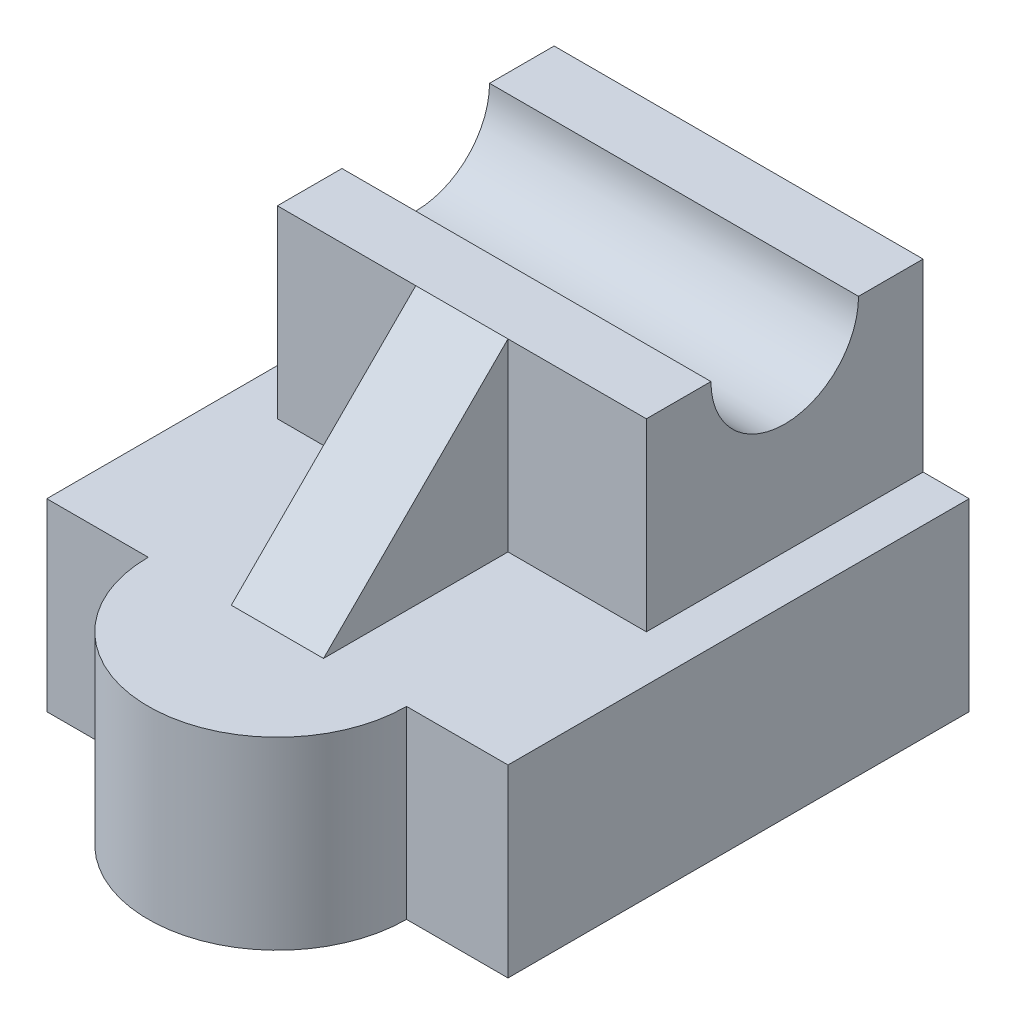
from build123d import *

# Parameters (mm, degrees)
SKETCH1_W           = 50
SKETCH1_H           = 20
BOSS_EXTRUDE1_DEPTH = 50
SKETCH2_W           = 40
SKETCH2_H           = 30
BOSS_EXTRUDE2_DEPTH = 20
CUT_EXTRUDE1_DEPTH  = 79.262379212
BOSS_EXTRUDE3_DEPTH = 20
BOSS_EXTRUDE4_DEPTH = 5


with BuildPart() as part:
    # Sketch1 → Boss-Extrude1 (new body)
    with BuildSketch(Plane.XY):
        with Locations((0, 10)):
            Rectangle(SKETCH1_W, SKETCH1_H)
    extrude(amount=BOSS_EXTRUDE1_DEPTH)

    # Sketch2 → Boss-Extrude2 (add)
    with BuildSketch(Plane(origin=(0, 20, 0), x_dir=(1, 0, 0), z_dir=(0, 1, 0))):
        with Locations((0, -15)):
            Rectangle(SKETCH2_W, SKETCH2_H)
    extrude(amount=BOSS_EXTRUDE2_DEPTH)

    # Sketch3 → Cut-Extrude1 (cut, through all)
    with BuildSketch(Plane(origin=(20, 0, 0), x_dir=(0, 0, -1), z_dir=(1, 0, 0))):
        with BuildLine():
            Line((-23, 40), (-7, 40))
            ThreePointArc((-7, 40), (-15, 32), (-23, 40))
        make_face()
    extrude(amount=-CUT_EXTRUDE1_DEPTH, mode=Mode.SUBTRACT)

    # Sketch4 → Boss-Extrude3 (add)
    with BuildSketch(Plane(origin=(0, 20, 0), x_dir=(1, 0, 0), z_dir=(0, 1, 0))):
        with BuildLine():
            Line((14, -50), (-14, -50))
            ThreePointArc((-14, -50), (0, -64), (14, -50))
        make_face()
    extrude(amount=-BOSS_EXTRUDE3_DEPTH)

    # Sketch5 → Boss-Extrude4 (add, symmetric)
    with BuildSketch(Plane(origin=(0, 0, 0), x_dir=(0, 0, -1), z_dir=(1, 0, 0))):
        Polygon((-30, 20), (-30, 40), (-50, 20), align=None)
    extrude(amount=BOSS_EXTRUDE4_DEPTH, both=True)


solid = part.part
